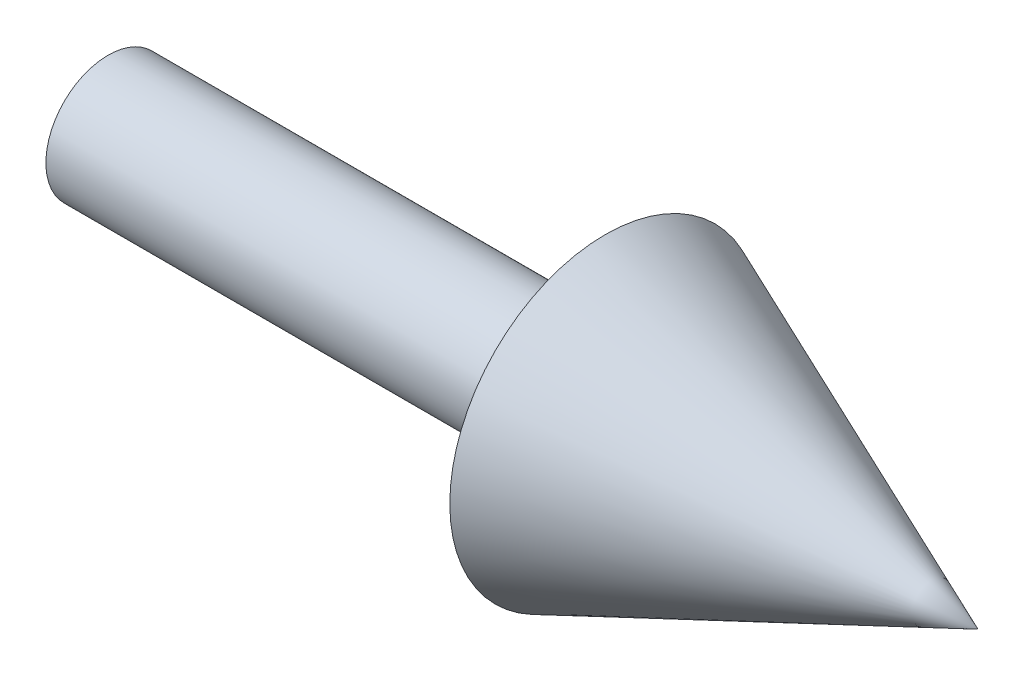
from build123d import *


with BuildPart() as part:
    # Sketch1 → Revolve1 (revolve)
    with BuildSketch(Plane.XY, mode=Mode.PRIVATE) as revolve1_sk:
        Polygon((0, 0), (0, 5), (40, 5), (40, 12.5), (70, 0), align=None)
    revolve(revolve1_sk.sketch.rotate(Axis((0, 0, 0), (-1, 0, 0)), 90), axis=Axis((0, 0, 0), (-1, 0, 0)))


solid = part.part
